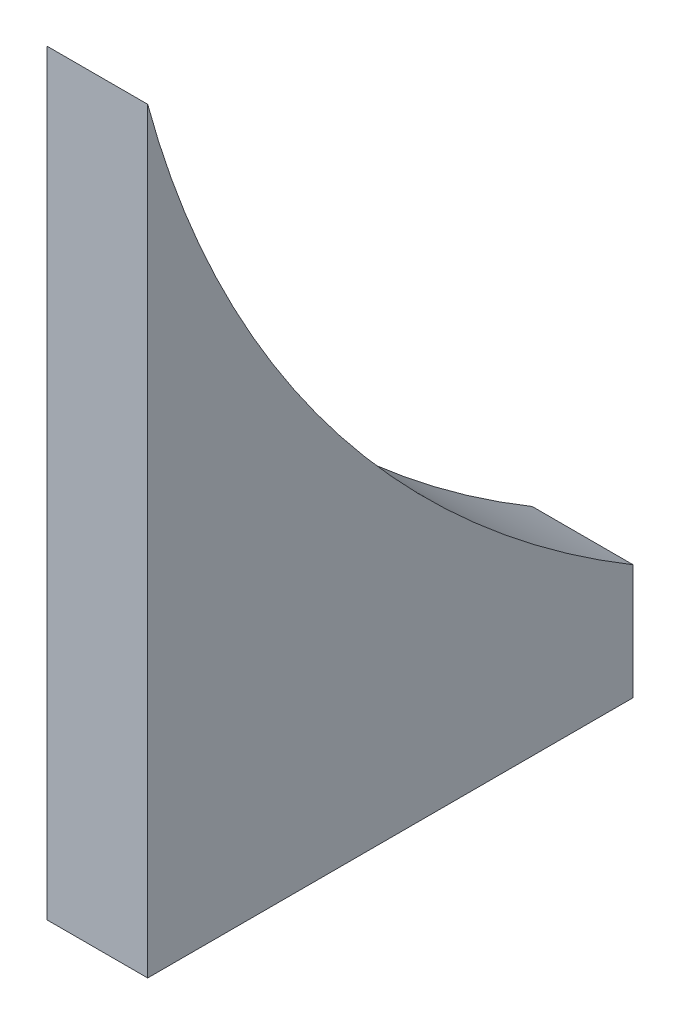
from build123d import *

# Parameters (mm, degrees)
BOSS_EXTRUDE1_DEPTH = 4
SKETCH2_W           = 10.75
SKETCH2_H           = 20.327264221
CUT_EXTRUDE1_DEPTH  = 4


with BuildPart() as part:
    # Sketch1 → Boss-Extrude1 (new body)
    with BuildSketch(Plane(origin=(0, 0, 0), x_dir=(0, 0, -1), z_dir=(1, 0, 0))):
        with BuildLine():
            Line((-11.867139326, 22.331980986), (-11.867139326, -7.668019014))
            Line((-11.867139326, -7.668019014), (18.132860674, -7.668019014))
            ThreePointArc((18.132860674, -7.668019014), (-0.870157122, 3.328963189), (-11.867139326, 22.331980986))
        make_face()
    extrude(amount=BOSS_EXTRUDE1_DEPTH)

    # Sketch2 → Cut-Extrude1 (cut)
    with BuildSketch(Plane(origin=(4, 0, 0), x_dir=(0, 0, -1), z_dir=(1, 0, 0))):
        with Locations((12.757860674, 2.495613097)):
            Rectangle(SKETCH2_W, SKETCH2_H)
    extrude(amount=-CUT_EXTRUDE1_DEPTH, mode=Mode.SUBTRACT)


solid = part.part
